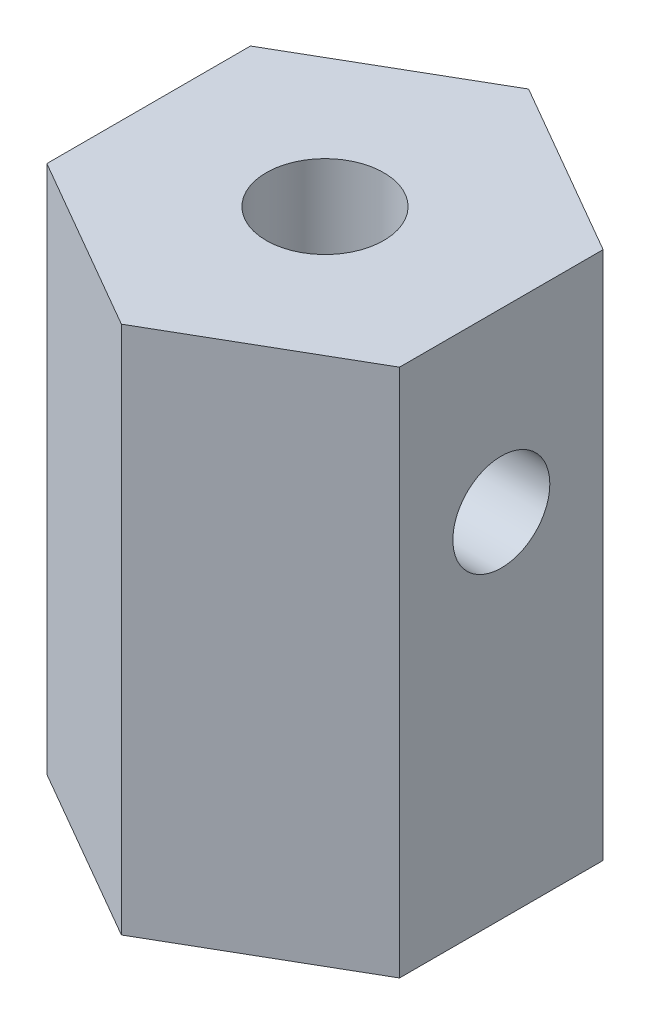
from build123d import *

# Parameters (mm, degrees)
BOSS_EXTRU_1_DEPTH                           = 18
ESQUISSE2_R                                  = 2
ENL_V_MAT_EXTRU_1_DEPTH                      = 10
TROU_POUR_TARAUDAGE_POUR_TROU_TARAUD_M4_D    = 3.3
TROU_POUR_TARAUDAGE_POUR_TROU_TARAUD_2_D     = 3.3
TROU_POUR_TARAUDAGE_POUR_TROU_TARAUD_2_DEPTH = 7


with BuildPart() as part:
    # Esquisse1 → Boss.-Extru.1 (new body)
    with BuildSketch(Plane(origin=(0, 0, 0), x_dir=(1, 0, 0), z_dir=(0, 1, 0))):
        Polygon((-6, -3.464101615), (0, -6.92820323), (6, -3.464101615), (6, 3.464101615), (0, 6.92820323), (-6, 3.464101615), align=None)
    extrude(amount=BOSS_EXTRU_1_DEPTH)

    # Esquisse2 → Enlèv. mat.-Extru.1 (cut)
    with BuildSketch(Plane(origin=(0, 18, 0), x_dir=(1, 0, 0), z_dir=(0, 1, 0))):
        with Locations(Location((0, 0, 0), (0, 0, 270))):
            Circle(ESQUISSE2_R)
    extrude(amount=-ENL_V_MAT_EXTRU_1_DEPTH, mode=Mode.SUBTRACT)

    # Trou pour taraudage pour trou taraud_ M4 (through all)
    with Locations(Plane(origin=(0, 0, 0), x_dir=(0, 0, -1), z_dir=(0, -1, 0))):
        with Locations((0, 0)):
            Hole(TROU_POUR_TARAUDAGE_POUR_TROU_TARAUD_M4_D / 2)

    # Trou pour taraudage pour trou taraud 2
    with Locations(Plane(origin=(6, 0, 0), x_dir=(0, 0, -1), z_dir=(1, 0, 0))):
        with Locations((0, 12)):
            Hole(TROU_POUR_TARAUDAGE_POUR_TROU_TARAUD_2_D / 2, depth=TROU_POUR_TARAUDAGE_POUR_TROU_TARAUD_2_DEPTH)


solid = part.part
